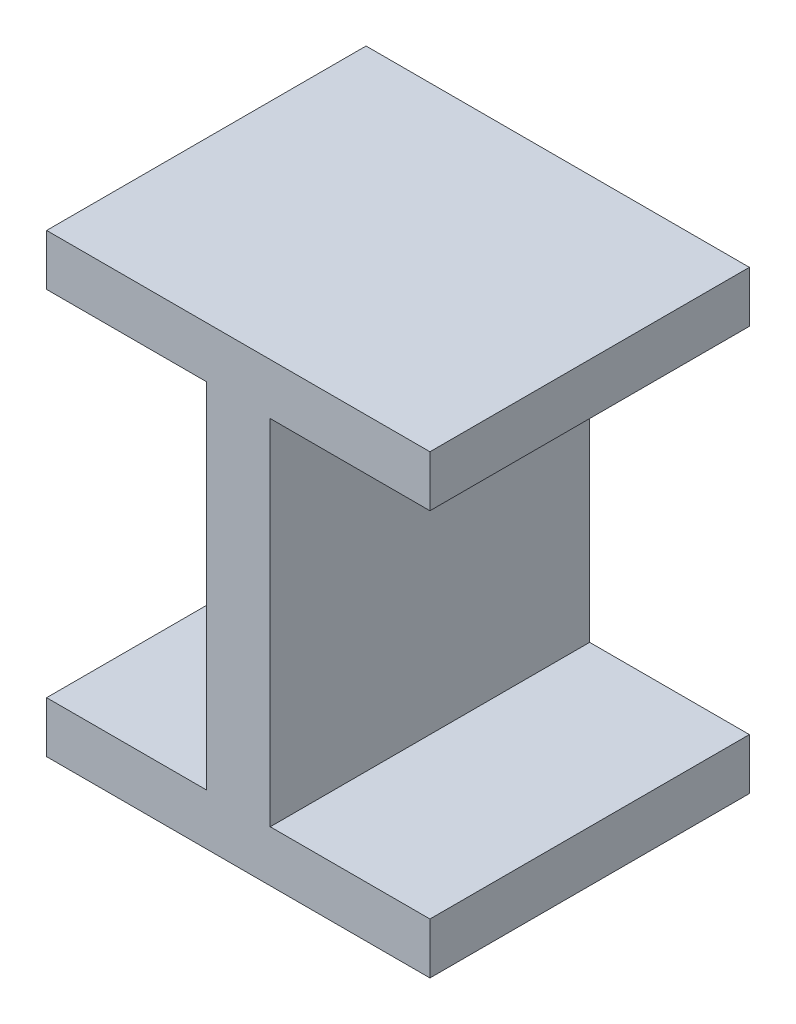
from build123d import *

# Parameters (mm, degrees)
BOSS_EXTRUDE1_DEPTH = 50


with BuildPart() as part:
    # Sketch1 → Boss-Extrude1 (new body)
    with BuildSketch(Plane.XY):
        Polygon((-30, -27.669066156), (-30, -35.669066156), (30, -35.669066156), (30, -27.669066156), (5, -27.669066156), (5, 27.669066156), (30, 27.669066156), (30, 35.669066156), (-30, 35.669066156), (-30, 27.669066156), (-5, 27.669066156), (-5, -27.669066156), align=None)
    extrude(amount=BOSS_EXTRUDE1_DEPTH)


solid = part.part
